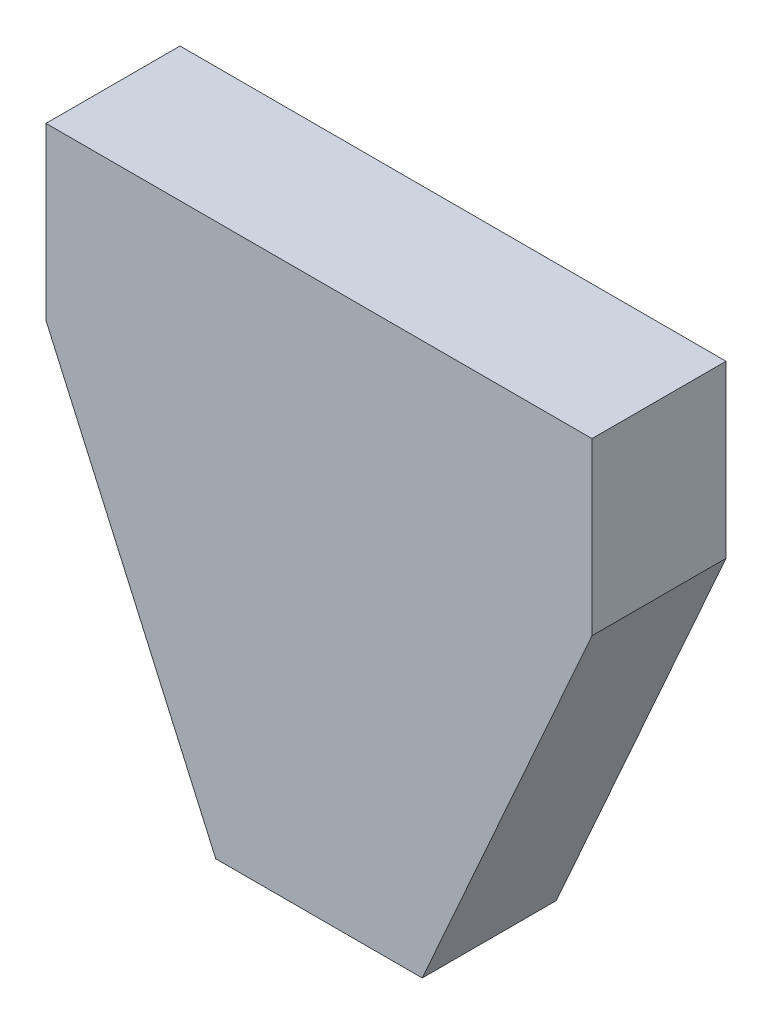
from build123d import *

# Parameters (mm, degrees)
BOSS_EXTRUDE1_DEPTH = 135
SHELL1_T            = -2


with BuildPart() as part:
    # Sketch1 → Boss-Extrude1 (new, symmetric)
    with BuildSketch(Plane.XY):
        Polygon((550, 500), (-550, 500), (-550, 156), (-208, -612.144576675), (208, -612.144576675), (550, 156), align=None)
    extrude(amount=BOSS_EXTRUDE1_DEPTH, both=True)

    # Shell1
    shell1_openings = [part.faces().sort_by_distance(p)[0] for p in [
        (0, 25.973898383, -135),
    ]]
    offset(amount=SHELL1_T, openings=shell1_openings, kind=Kind.INTERSECTION)


solid = part.part
